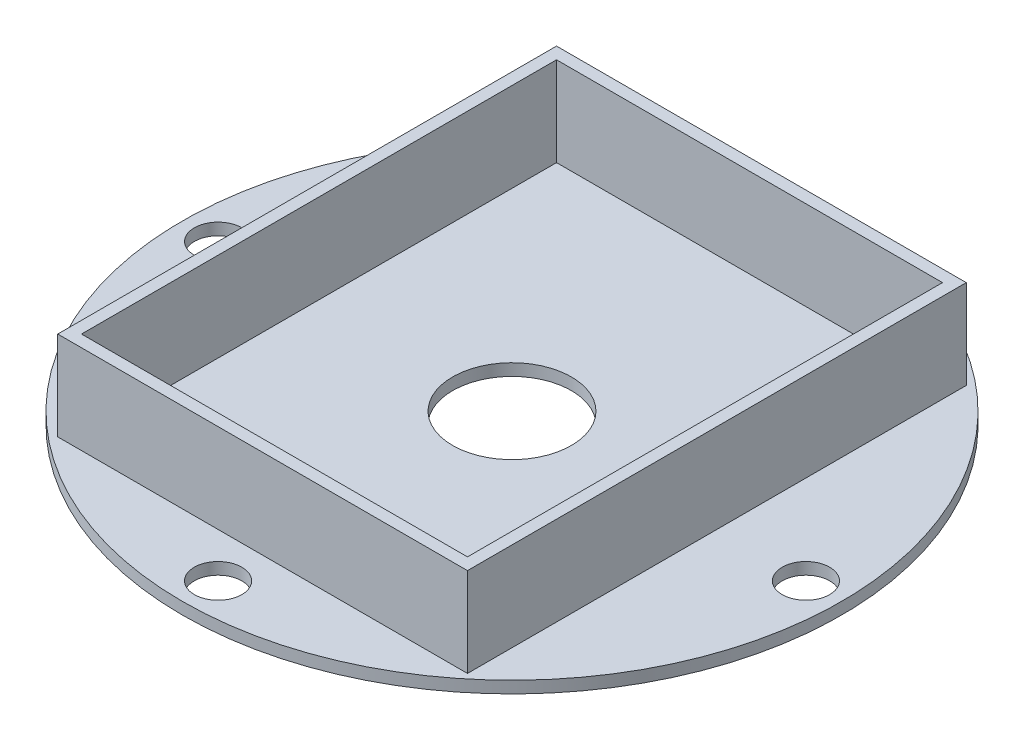
from build123d import *

# Parameters (mm, degrees)
SKETCH1_R           = 55.5
SKETCH1_R_2         = 4
BOSS_EXTRUDE4_DEPTH = 2
SKETCH6_W           = 69
SKETCH6_H           = 84
SKETCH6_W_2         = 65
SKETCH6_H_2         = 80
BOSS_EXTRUDE5_DEPTH = 15
SKETCH7_R           = 10
CUT_EXTRUDE2_DEPTH  = 30


with BuildPart() as part:
    # Sketch1 → Boss-Extrude4 (new body)
    with BuildSketch(Plane(origin=(0, 0, 0), x_dir=(1, 0, 0), z_dir=(0, 1, 0))):
        with Locations(Location((0, 0, 0), (0, 0, 270))):
            Circle(SKETCH1_R)
        with Locations(Location((0, 49.5, 0), (0, 0, 270))):
            Circle(SKETCH1_R_2, mode=Mode.SUBTRACT)
        with Locations(Location((49.5, 0, 0), (0, 0, 270))):
            Circle(SKETCH1_R_2, mode=Mode.SUBTRACT)
        with Locations(Location((-49.5, 0, 0), (0, 0, 270))):
            Circle(SKETCH1_R_2, mode=Mode.SUBTRACT)
        with Locations(Location((0, -49.5, 0), (0, 0, 270))):
            Circle(SKETCH1_R_2, mode=Mode.SUBTRACT)
    extrude(amount=BOSS_EXTRUDE4_DEPTH)

    # Sketch6 → Boss-Extrude5 (add)
    with BuildSketch(Plane(origin=(0, 2, 0), x_dir=(1, 0, 0), z_dir=(0, 1, 0))):
        Rectangle(SKETCH6_W, SKETCH6_H)
        Rectangle(SKETCH6_W_2, SKETCH6_H_2, mode=Mode.SUBTRACT)
    extrude(amount=BOSS_EXTRUDE5_DEPTH)

    # Sketch7 → Cut-Extrude2 (cut)
    with BuildSketch(Plane(origin=(0, 2, 0), x_dir=(1, 0, 0), z_dir=(0, 1, 0))):
        with Locations(Location((0, 0, 0), (0, 0, 270))):
            Circle(SKETCH7_R)
    extrude(amount=-CUT_EXTRUDE2_DEPTH, mode=Mode.SUBTRACT)


solid = part.part
